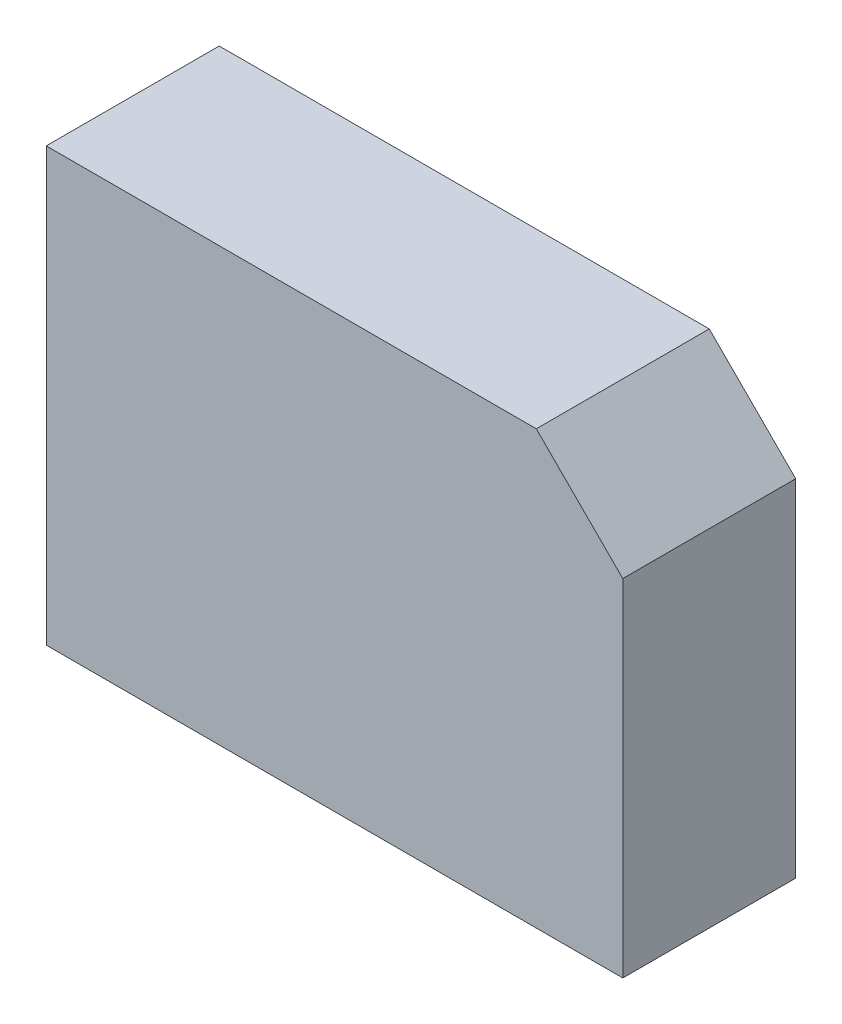
from build123d import *

# Parameters (mm, degrees)
SKETCH_1_W      = 20
SKETCH_1_H      = 15
EXTRUDE_1_DEPTH = 3
CHAMFER_1_SIZE  = 3


with BuildPart() as part:
    # 草图1 → 凸台-拉伸1 (new, symmetric)
    with BuildSketch(Plane.XY):
        Rectangle(SKETCH_1_W, SKETCH_1_H)
    extrude(amount=EXTRUDE_1_DEPTH, both=True)

    # 倒角1
    chamfer_1_edges = [part.edges().sort_by_distance(p)[0] for p in [
        (10, 7.5, 0),
    ]]
    chamfer(chamfer_1_edges, length=CHAMFER_1_SIZE)


solid = part.part
